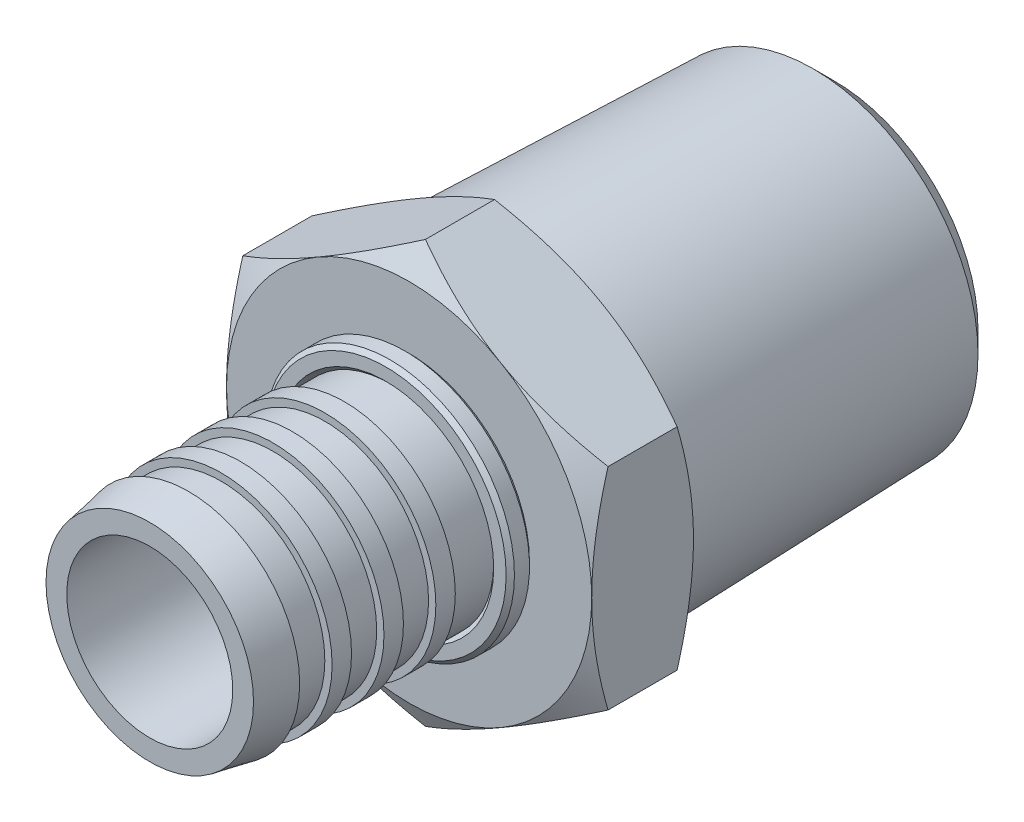
from build123d import *

# Parameters (mm, degrees)
SKETCH16_R          = 11.176
CUT_EXTRUDE4_DEPTH  = 28.168503014
CHAMFER1_SIZE       = 1.27
CHAMFER1_SIZE2      = 1.311447455
BOSS_EXTRUDE1_START = -6.223
SKETCH10_R          = 8.001
BOSS_EXTRUDE1_DEPTH = 6.223
SKETCH11_OUTSIDE_W  = 135.36
SKETCH11_OUTSIDE_H  = 138.818
SKETCH11_OUTSIDE_R  = 11.176
CUT_EXTRUDE1_DEPTH  = 28.924216754
CUT_EXTRUDE1_DRAFT  = -60
SKETCH12_OUTSIDE_W  = 146.476
SKETCH12_OUTSIDE_H  = 149.934
SKETCH12_OUTSIDE_R  = 11.176
CUT_EXTRUDE2_DEPTH  = 32.132964882
CUT_EXTRUDE2_DRAFT  = 60
SKETCH18_W          = 1.42875
SKETCH18_H          = 1.27
CHAMFER2_SIZE       = 0.254


with BuildPart() as part:
    # Sketch1 → Revolve1 (revolve)
    with BuildSketch(Plane(origin=(0, 0, 0), x_dir=(0, 0, -1), z_dir=(1, 0, 0)), mode=Mode.PRIVATE) as revolve1_sk:
        Polygon((-18.57375, 6.35), (-16.589375, 6.35), (-16.589375, 6.7945), (-15.39875, 6.7945), (-15.39875, 6.35), (-13.414375, 6.35), (-13.414375, 6.7945), (-12.22375, 6.7945), (-12.22375, 6.35), (-10.239375, 6.35), (-10.239375, 6.7945), (-9.04875, 6.7945), (-9.04875, 6.35), (-5.08, 6.35), (-5.08, 11.176), (1.143, 11.176), (1.143, 10.668), (20.955, 10.051151533), (20.955, 8.001), (-1.9685, 8.001), (-3.52425, 5.08), (-20.955, 5.08), (-20.955, 6.35), (-18.57375, 6.7945), align=None)
    revolve(revolve1_sk.sketch.rotate(Axis((0, 0, 20.955), (0, 0, -1)), 90), axis=Axis((0, 0, 20.955), (0, 0, -1)))

    # Sketch16 → Cut-Extrude4 (cut, through all)
    with BuildSketch(Plane(origin=(0, 0, -1.143), x_dir=(-1, 0, 0), z_dir=(0, 0, -1))):
        with Locations(Location((0, 0, 0), (0, 0, 180))):
            Circle(SKETCH16_R)
    extrude(amount=CUT_EXTRUDE4_DEPTH, mode=Mode.SUBTRACT)

    # Sketch10 → Boss-Extrude1 (add)
    with BuildSketch(Plane(origin=(0, 0, -1.143), x_dir=(-1, 0, 0), z_dir=(0, 0, -1)).offset(BOSS_EXTRUDE1_START)):
        Polygon((11.176, 6.452466608), (0, 12.904933217), (-11.176, 6.452466608), (-11.176, -6.452466608), (0, -12.904933217), (11.176, -6.452466608), align=None)
        with Locations(Location((0, 0, 0), (0, 0, 180))):
            Circle(SKETCH10_R, mode=Mode.SUBTRACT)
    extrude(amount=BOSS_EXTRUDE1_DEPTH)


with BuildPart() as body_2:
    # Sketch17 → Revolve2 (revolve)
    with BuildSketch(Plane(origin=(0, 0, 0), x_dir=(0, 0, -1), z_dir=(1, 0, 0)), mode=Mode.PRIVATE) as revolve2_sk:
        Polygon((20.955, 8.001), (1.143, 8.001), (1.143, 10.668), (20.955, 10.051151533), align=None)
    revolve(revolve2_sk.sketch.rotate(Axis((0, 0, 20.955), (0, 0, -1)), 90), axis=Axis((0, 0, 20.955), (0, 0, -1)))

    # Chamfer1
    chamfer1_edges = [body_2.edges().sort_by_distance(p)[0] for p in [
        (-10.051151533, 0, -20.955),
    ]]
    chamfer1_side = [body_2.faces().sort_by_distance(p)[0] for p in [
        (-9.766862037, 0, -20.955),
    ]]
    chamfer(chamfer1_edges, length=CHAMFER1_SIZE, length2=CHAMFER1_SIZE2, reference=chamfer1_side[0])


with BuildPart() as cut_extrude1_tool:
    # Sketch11 outside → Cut-Extrude1 (with draft: the straight prism first)
    with BuildSketch(Plane(origin=(0, 0, -1.143), x_dir=(-1, 0, 0), z_dir=(0, 0, -1))):
        Rectangle(SKETCH11_OUTSIDE_W, SKETCH11_OUTSIDE_H)
        Circle(SKETCH11_OUTSIDE_R, mode=Mode.SUBTRACT)
    extrude(amount=-CUT_EXTRUDE1_DEPTH)
    # Cut-Extrude1: the draft: its side faces are tilted about the plane it starts from
    cut_extrude1_sides = [cut_extrude1_tool.faces().sort_by_distance(p)[0] for p in [
        (0, -69.409, 13.319108377),
        (-67.68, 0, 13.319108377),
        (0, 69.409, 13.319108377),
        (67.68, 0, 13.319108377),
        (11.176, 0, 13.319108377),
    ]]
    draft(cut_extrude1_sides, Plane(origin=(0, 0, -1.143), x_dir=(-1, 0, 0), z_dir=(0, 0, -1)), CUT_EXTRUDE1_DRAFT)


with BuildPart() as part_1:
    add(part.part)

    # Cut-Extrude1: cut by cut_extrude1_tool
    add(cut_extrude1_tool.part, mode=Mode.SUBTRACT)


with BuildPart() as cut_extrude2_tool:
    # Sketch12 outside → Cut-Extrude2 (with draft: the straight prism first)
    with BuildSketch(Plane(origin=(0, 0, 5.08), x_dir=(-1, 0, 0), z_dir=(0, 0, -1))):
        Rectangle(SKETCH12_OUTSIDE_W, SKETCH12_OUTSIDE_H)
        Circle(SKETCH12_OUTSIDE_R, mode=Mode.SUBTRACT)
    extrude(amount=CUT_EXTRUDE2_DEPTH)
    # Cut-Extrude2: the draft: its side faces are tilted about the plane it starts from
    cut_extrude2_sides = [cut_extrude2_tool.faces().sort_by_distance(p)[0] for p in [
        (0, -74.967, -10.986482441),
        (-73.238, 0, -10.986482441),
        (0, 74.967, -10.986482441),
        (73.238, 0, -10.986482441),
        (11.176, 0, -10.986482441),
    ]]
    draft(cut_extrude2_sides, Plane(origin=(0, 0, 5.08), x_dir=(-1, 0, 0), z_dir=(0, 0, -1)), CUT_EXTRUDE2_DRAFT)


with BuildPart() as part_2:
    add(part_1.part)

    # Cut-Extrude2: cut by cut_extrude2_tool
    add(cut_extrude2_tool.part, mode=Mode.SUBTRACT)

    # Combine1: union body 2
    add(body_2.part)


with BuildPart() as body_3:
    # Sketch18 → Revolve3 (revolve)
    with BuildSketch(Plane(origin=(0, 0, 0), x_dir=(0, 0, -1), z_dir=(1, 0, 0)), mode=Mode.PRIVATE) as revolve3_sk:
        with Locations((-5.794375, 6.985)):
            Rectangle(SKETCH18_W, SKETCH18_H)
    revolve(revolve3_sk.sketch.rotate(Axis((0, 0, 0), (0, 0, 1)), 90), axis=Axis((0, 0, 0), (0, 0, 1)))

    # Chamfer2
    chamfer2_edges = [body_3.edges().sort_by_distance(p)[0] for p in [
        (7.62, 0, 6.50875),
        (7.62, 0, 5.08),
        (6.35, 0, 5.08),
        (6.35, 0, 6.50875),
    ]]
    chamfer(chamfer2_edges, length=CHAMFER2_SIZE)


solid = Compound([part_2.part, body_3.part])
